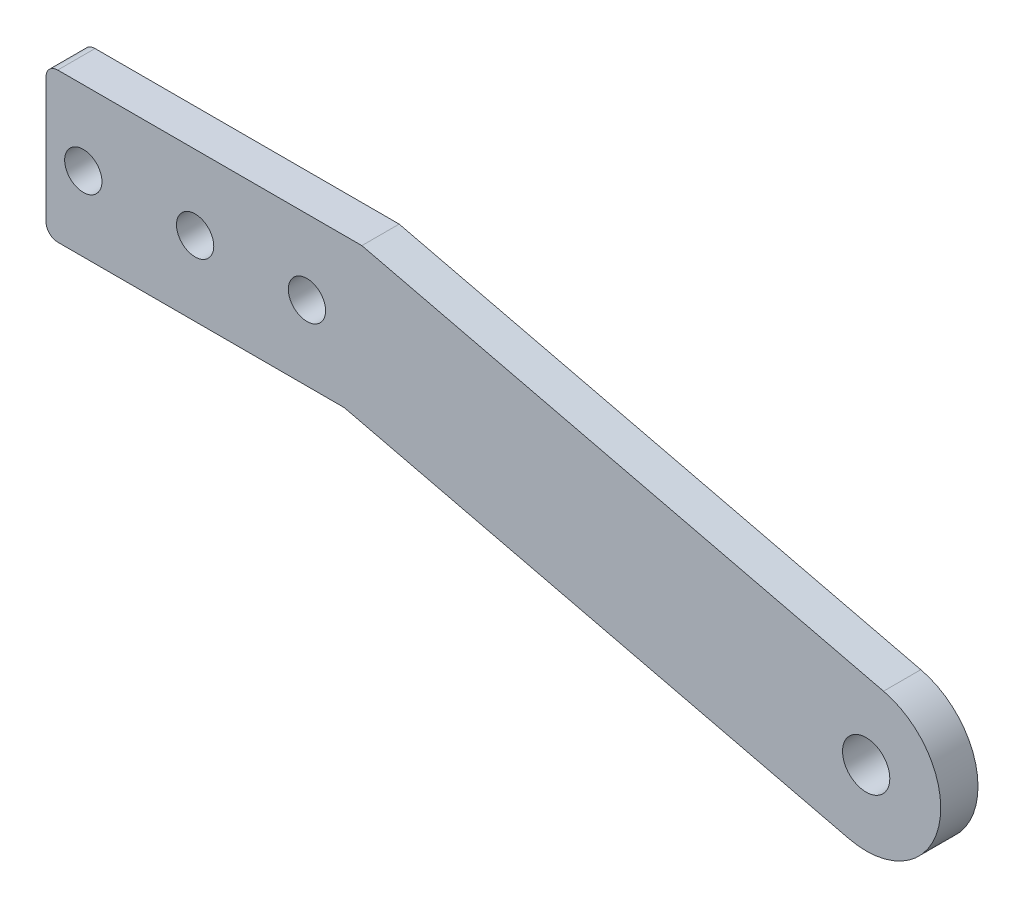
from build123d import *

# Parameters (mm, degrees)
SKETCH1_R           = 3.175
SKETCH1_R_2         = 4.025
BOSS_EXTRUDE1_DEPTH = 6.35


with BuildPart() as part:
    # Sketch1 → Boss-Extrude1 (new body)
    with BuildSketch(Plane.XY):
        with BuildLine():
            Line((91.860390313, -8.599854689), (3.001735639, 12.7))
            Line((3.001735639, 12.7), (-48.8, 12.7))
            ThreePointArc((-48.8, 12.7), (-50.214213562, 12.114213562), (-50.8, 10.7))
            Line((-50.8, 10.7), (-50.8, -10.7))
            ThreePointArc((-50.8, -10.7), (-50.214213562, -12.114213562), (-48.8, -12.7))
            Line((-48.8, -12.7), (0, -12.7))
            Line((0, -12.7), (85.939609687, -33.300145311))
            ThreePointArc((85.939609687, -33.300145311), (101.250145311, -23.910390313), (91.860390313, -8.599854689))
        make_face()
        with Locations((-25.4, 0)):
            Circle(SKETCH1_R, mode=Mode.SUBTRACT)
        with Locations((88.9, -20.95)):
            Circle(SKETCH1_R_2, mode=Mode.SUBTRACT)
        with Locations((-44.45, 0)):
            Circle(SKETCH1_R, mode=Mode.SUBTRACT)
        with Locations((-6.35, 0)):
            Circle(SKETCH1_R, mode=Mode.SUBTRACT)
    extrude(amount=BOSS_EXTRUDE1_DEPTH)


solid = part.part
